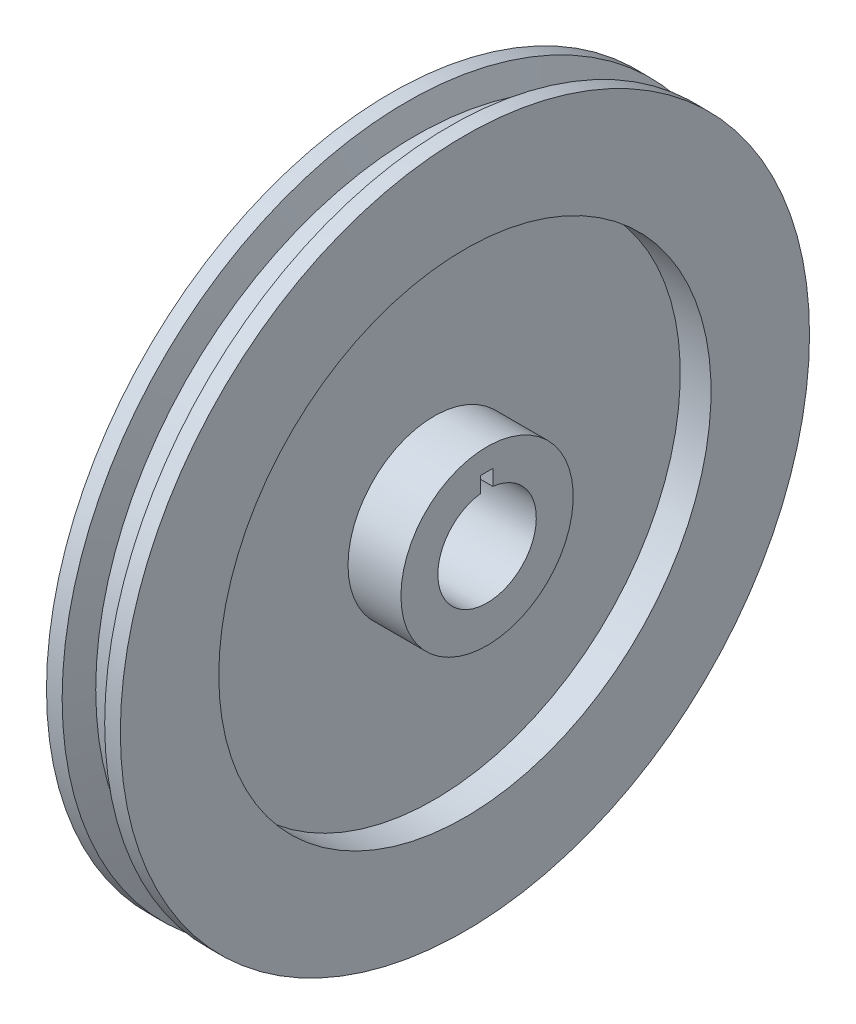
from build123d import *

# Parameters (mm, degrees)
SKETCH2_W          = 63.5
SKETCH2_H          = 152.4
CUT_EXTRUDE1_DEPTH = 1270


with BuildPart() as part:
    # Sketch1 → Revolve1 (revolve)
    with BuildSketch(Plane(origin=(0, 0, 0), x_dir=(1, 0, 0), z_dir=(0, 1, 0)), mode=Mode.PRIVATE) as revolve1_sk:
        Polygon((-19.05, -33.125663276), (254, -33.125663276), (254, -223.625663276), (-254, -223.625663276), (-254, -33.125663276), (-82.55, -33.125663276), (-82.55, 792.374336724), (-241.3, 792.374336724), (-241.3, 1300.374336724), (-160.524219752, 1300.374336724), (-114.3, 1173.374336724), (12.7, 1173.374336724), (58.924219752, 1300.374336724), (139.7, 1300.374336724), (139.7, 792.374336724), (-19.05, 792.374336724), align=None)
    revolve(revolve1_sk.sketch.rotate(Axis((0, 0, 477.625663276), (1, 0, 0)), 180), axis=Axis((0, 0, 477.625663276), (1, 0, 0)))

    # Sketch2 → Cut-Extrude1 (cut)
    with BuildSketch(Plane.ZY.offset(254)):
        with Locations((480.068106278, 255.998478736)):
            Rectangle(SKETCH2_W, SKETCH2_H)
    extrude(amount=-CUT_EXTRUDE1_DEPTH, mode=Mode.SUBTRACT)


solid = part.part
